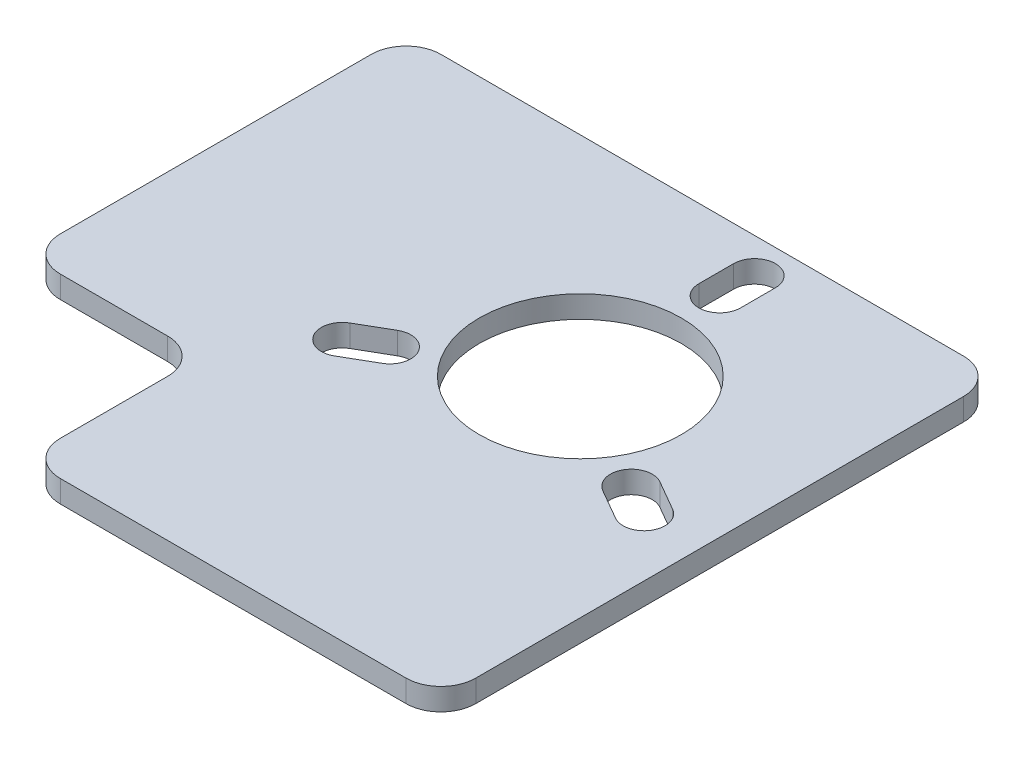
from build123d import *

# Parameters (mm, degrees)
SKETCH1_W           = 170
SKETCH1_H           = 160
SKETCH1_R           = 29
BOSS_EXTRUDE1_DEPTH = 6.35
SKETCH2_W           = 50.8
SKETCH2_H           = 50.8
CUT_EXTRUDE1_DEPTH  = 234.538695937
FILLET1_R           = 10
CUT_EXTRUDE2_DEPTH  = 234.538695937


with BuildPart() as part:
    # Sketch1 → Boss-Extrude1 (new body)
    with BuildSketch(Plane(origin=(0, 0, 0), x_dir=(1, 0, 0), z_dir=(0, 1, 0))):
        with Locations((85, 80)):
            Rectangle(SKETCH1_W, SKETCH1_H)
        with Locations(Location((110, 100, 0), (0, 0, 270))):
            Circle(SKETCH1_R, mode=Mode.SUBTRACT)
    extrude(amount=BOSS_EXTRUDE1_DEPTH)

    # Sketch2 → Cut-Extrude1 (cut, through all)
    with BuildSketch(Plane(origin=(0, 6.35, 0), x_dir=(1, 0, 0), z_dir=(0, 1, 0))):
        with Locations((25.4, 25.4)):
            Rectangle(SKETCH2_W, SKETCH2_H)
    extrude(amount=-CUT_EXTRUDE1_DEPTH, mode=Mode.SUBTRACT)

    # Fillet1
    fillet1_edges = [part.edges().sort_by_distance(p)[0] for p in [
        (0, 3.175, -50.8),
        (50.8, 3.175, -50.8),
        (50.8, 3.175, 0),
        (0, 3.175, -160),
        (170, 3.175, -160),
        (170, 3.175, 0),
    ]]
    fillet(fillet1_edges, radius=FILLET1_R)

    # Sketch3 → Cut-Extrude2 (cut, through all)
    with BuildSketch(Plane(origin=(0, 6.35, 0), x_dir=(1, 0, 0), z_dir=(0, 1, 0))):
        with BuildLine():
            Line((63.698729811, 80.196152423), (72.358983849, 85.196152423))
            ThreePointArc((72.358983849, 85.196152423), (80.555136271, 83), (78.358983849, 74.803847577))
            Line((78.358983849, 74.803847577), (69.698729811, 69.803847577))
            ThreePointArc((69.698729811, 69.803847577), (61.502577388, 72), (63.698729811, 80.196152423))
        make_face()
        with BuildLine():
            Line((150.301270189, 69.803847577), (141.641016151, 74.803847577))
            ThreePointArc((141.641016151, 74.803847577), (139.444863729, 83), (147.641016151, 85.196152423))
            Line((147.641016151, 85.196152423), (156.301270189, 80.196152423))
            ThreePointArc((156.301270189, 80.196152423), (158.497422612, 72), (150.301270189, 69.803847577))
        make_face()
        with BuildLine():
            Line((116, 150), (116, 140))
            ThreePointArc((116, 140), (110, 134), (104, 140))
            Line((104, 140), (104, 150))
            ThreePointArc((104, 150), (110, 156), (116, 150))
        make_face()
    extrude(amount=-CUT_EXTRUDE2_DEPTH, mode=Mode.SUBTRACT)


solid = part.part
